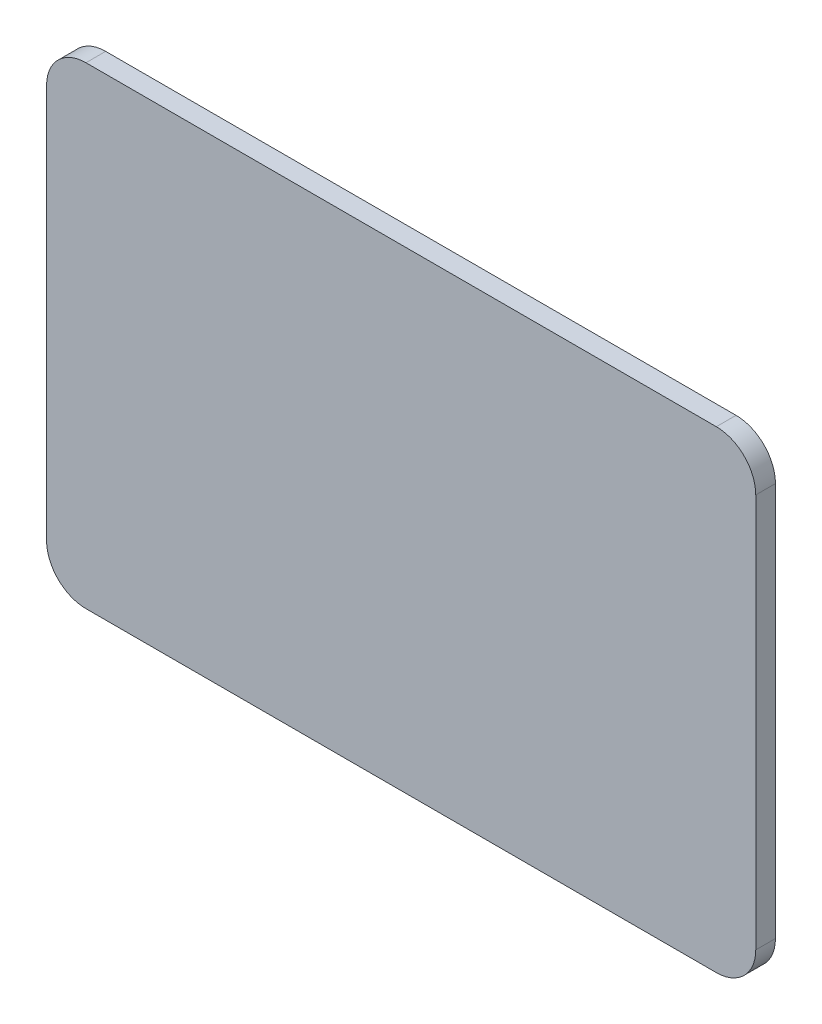
from build123d import *

# Parameters (mm, degrees)
SKETCH1_W           = 114.3
SKETCH1_H           = 76.2
BOSS_EXTRUDE1_DEPTH = 3.175
FILLET1_R           = 6.35


with BuildPart() as part:
    # Sketch1 → Boss-Extrude1 (new body)
    with BuildSketch(Plane.XY):
        Rectangle(SKETCH1_W, SKETCH1_H)
    extrude(amount=BOSS_EXTRUDE1_DEPTH)

    # Fillet1
    fillet1_edges = [part.edges().sort_by_distance(p)[0] for p in [
        (57.15, -38.1, 1.5875),
        (-57.15, -38.1, 1.5875),
        (-57.15, 38.1, 1.5875),
        (57.15, 38.1, 1.5875),
    ]]
    fillet(fillet1_edges, radius=FILLET1_R)


solid = part.part
